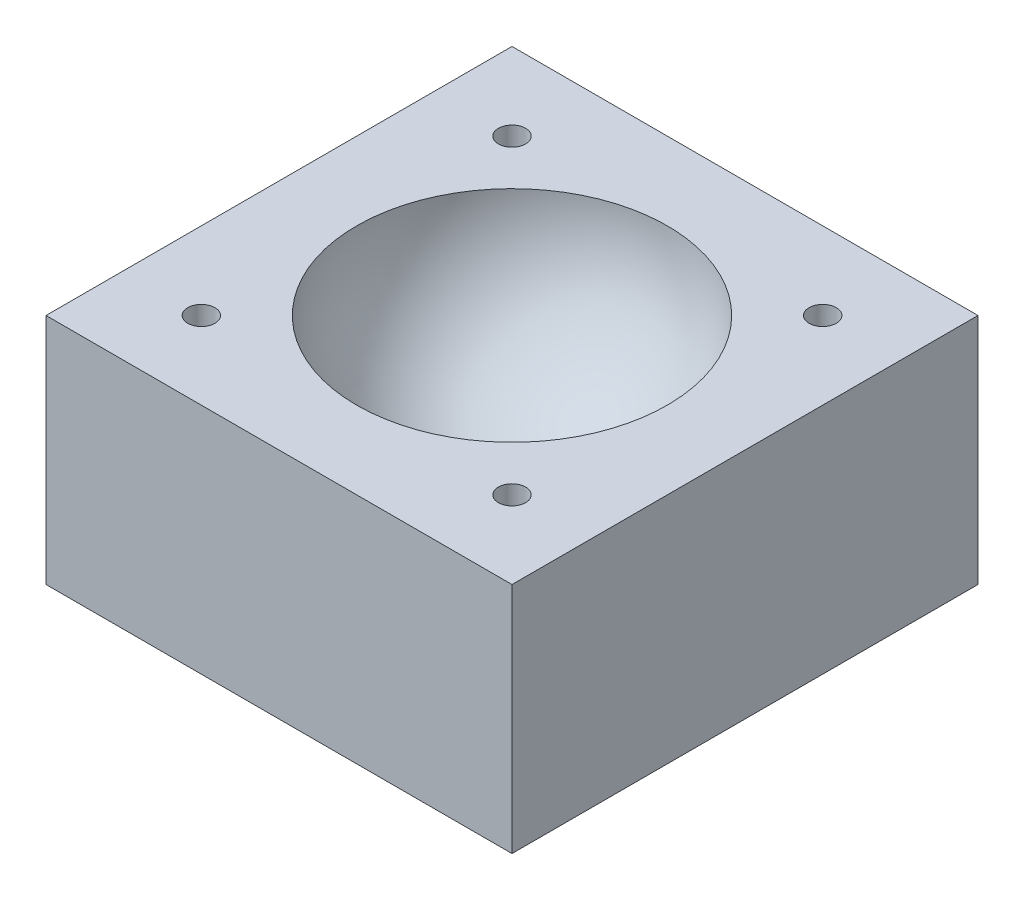
from build123d import *

# Parameters (mm, degrees)
SKETCH1_W           = 60
SKETCH1_H           = 60
BOSS_EXTRUDE1_DEPTH = 30
CUT_REVOLVE1_ANGLE  = 180
SKETCH3_R           = 1.75
CUT_EXTRUDE1_DEPTH  = 30


with BuildPart() as part:
    # Sketch1 → Boss-Extrude1 (new body)
    with BuildSketch(Plane(origin=(0, 0, 0), x_dir=(1, 0, 0), z_dir=(0, 1, 0))):
        Rectangle(SKETCH1_W, SKETCH1_H)
    extrude(amount=BOSS_EXTRUDE1_DEPTH)

    # Sketch2 → Cut-Revolve1 (revolve, cut)
    with BuildSketch(Plane(origin=(0, 30, 0), x_dir=(1, 0, 0), z_dir=(0, 1, 0))):
        with BuildLine():
            Line((0, 20), (0, -20))
            ThreePointArc((0, -20), (20, 0), (0, 20))
        make_face()
    revolve(axis=Axis((0, 30, -20), (0, 0, -1)), revolution_arc=CUT_REVOLVE1_ANGLE, mode=Mode.SUBTRACT)

    # Sketch3 → Cut-Extrude1 (cut)
    with BuildSketch(Plane(origin=(0, 30, 0), x_dir=(1, 0, 0), z_dir=(0, 1, 0))):
        with Locations(Location((-20, 20, 0), (0, 0, 270))):
            Circle(SKETCH3_R)
        with Locations(Location((-20, -20, 0), (0, 0, 270))):
            Circle(SKETCH3_R)
        with Locations(Location((20, 20, 0), (0, 0, 270))):
            Circle(SKETCH3_R)
        with Locations(Location((20, -20, 0), (0, 0, 270))):
            Circle(SKETCH3_R)
    extrude(amount=-CUT_EXTRUDE1_DEPTH, mode=Mode.SUBTRACT)


solid = part.part
